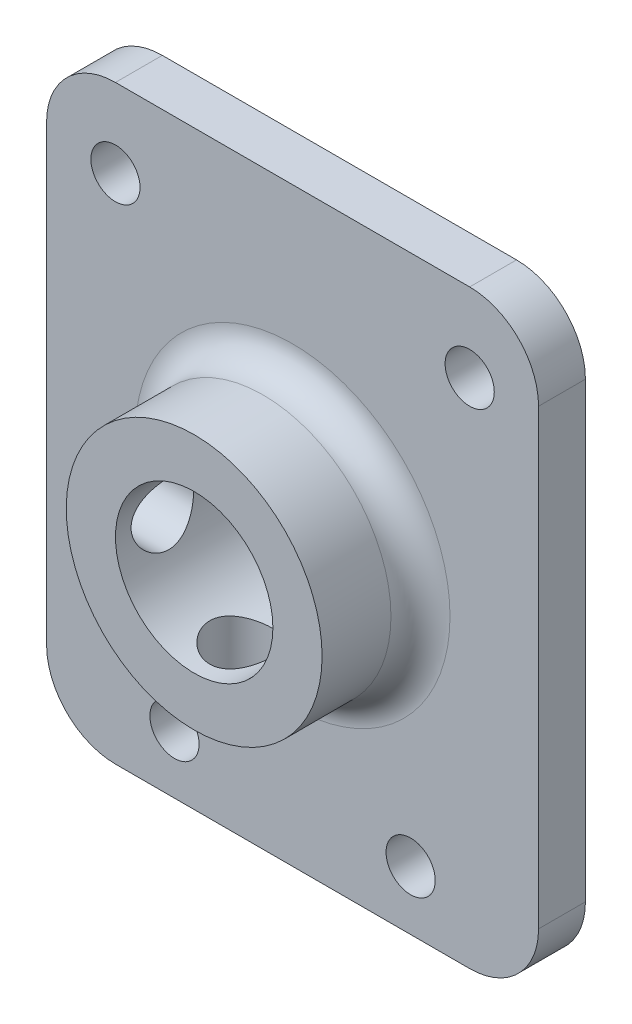
from build123d import *

# Parameters (mm, degrees)
CROQUIS1_W              = 50
CROQUIS1_H              = 60
SALIENTE_EXTRUIR1_DEPTH = 4.7625
CROQUIS2_R              = 13
SALIENTE_EXTRUIR2_DEPTH = 10
CROQUIS3_R              = 8
CORTAR_EXTRUIR1_DEPTH   = 42.748429985
CROQUIS4_R              = 2.5
CORTAR_EXTRUIR2_DEPTH   = 41.311288741
REDONDEO1_R             = 3
REDONDEO2_R             = 7
CROQUIS5_R              = 3.175
CORTAR_EXTRUIR3_DEPTH   = 42.748429985
CROQUIS6_R              = 3.175
CORTAR_EXTRUIR4_DEPTH   = 42.748430021


with BuildPart() as part:
    # Croquis1 → Saliente-Extruir1 (new body)
    with BuildSketch(Plane.XY):
        Rectangle(CROQUIS1_W, CROQUIS1_H)
    extrude(amount=SALIENTE_EXTRUIR1_DEPTH)

    # Croquis2 → Saliente-Extruir2 (add)
    with BuildSketch(Plane.XY.offset(4.7625)):
        Circle(CROQUIS2_R)
    extrude(amount=SALIENTE_EXTRUIR2_DEPTH)

    # Croquis3 → Cortar-Extruir1 (cut, through all)
    with BuildSketch(Plane.XY.offset(14.7625)):
        Circle(CROQUIS3_R)
    extrude(amount=-CORTAR_EXTRUIR1_DEPTH, mode=Mode.SUBTRACT)

    # Croquis4 → Cortar-Extruir2 (cut, through all)
    with BuildSketch(Plane.XY.offset(4.7625)):
        with Locations((18, 22)):
            Circle(CROQUIS4_R)
        with Locations((12, -24)):
            Circle(CROQUIS4_R)
        with Locations((-12, -24)):
            Circle(CROQUIS4_R)
        with Locations((-18, 22)):
            Circle(CROQUIS4_R)
    extrude(amount=-CORTAR_EXTRUIR2_DEPTH, mode=Mode.SUBTRACT)

    # Redondeo1
    redondeo1_edges = [part.edges().sort_by_distance(p)[0] for p in [
        (-13, 0, 4.7625),
    ]]
    fillet(redondeo1_edges, radius=REDONDEO1_R)

    # Redondeo2
    redondeo2_edges = [part.edges().sort_by_distance(p)[0] for p in [
        (25, -30, 2.38125),
        (-25, -30, 2.38125),
        (-25, 30, 2.38125),
        (25, 30, 2.38125),
    ]]
    fillet(redondeo2_edges, radius=REDONDEO2_R)

    # Croquis5 → Cortar-Extruir3 (cut, through all)
    with BuildSketch(Plane(origin=(0, 0, 0), x_dir=(1, 0, 0), z_dir=(0, 1, 0))):
        with Locations(Location((0, -10, 0), (0, 0, 270))):
            Circle(CROQUIS5_R)
    extrude(amount=-CORTAR_EXTRUIR3_DEPTH, mode=Mode.SUBTRACT)

    # Croquis6 → Cortar-Extruir4 (cut, through all)
    with BuildSketch(Plane(origin=(0, 0, 0), x_dir=(0, 0, -1), z_dir=(1, 0, 0))):
        with Locations((-10, 0)):
            Circle(CROQUIS6_R)
    extrude(amount=-CORTAR_EXTRUIR4_DEPTH, mode=Mode.SUBTRACT)


solid = part.part
